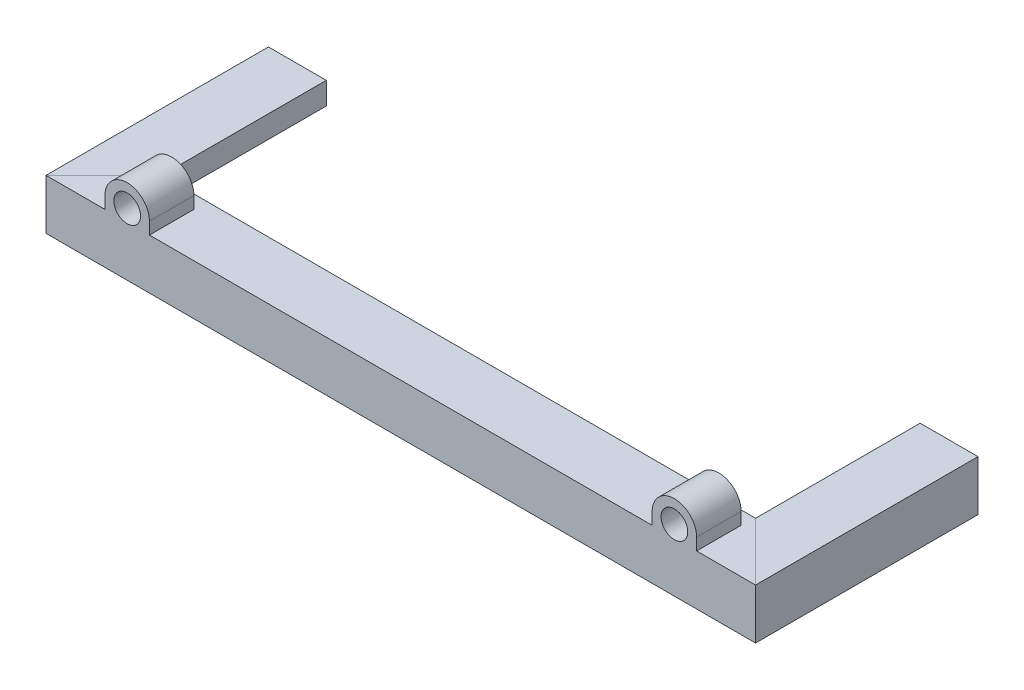
from build123d import *

# Parameters (mm, degrees)
SALIENTE_EXTRUIR1_DEPTH = 10
CROQUIS5_R              = 3
CORTAR_EXTRUIR1_DEPTH   = 169.229753611


with BuildPart() as part:
    # Barrer1: sweep along a path in Croquis3
    with BuildLine(Plane(origin=(0, 0, 0), x_dir=(1, 0, 0), z_dir=(0, 1, 0))) as barrer1_path:
        Line((0, 0), (0, -50))
        Line((0, -50), (159.5, -50))
        Line((159.5, -50), (159.5, 0))
    # Croquis1 → Barrer1 (sweep)
    with BuildSketch(Plane.XY):
        Polygon((0, 0), (0, 11.3), (13, 11.3), (13, 6.3), (5, 6.3), (5, 0), align=None)
    sweep(path=barrer1_path.line, transition=Transition.RIGHT)

    # Croquis4 → Saliente-Extruir1 (add)
    with BuildSketch(Plane.XY.offset(50)):
        with BuildLine():
            Line((13.25, 11.3), (23.25, 11.3))
            Line((23.25, 11.3), (23.25, 14))
            ThreePointArc((23.25, 14), (18.25, 19), (13.25, 14))
            Line((13.25, 14), (13.25, 11.3))
        make_face()
    saliente_extruir1 = extrude(amount=-SALIENTE_EXTRUIR1_DEPTH)

    # Croquis5 → Cortar-Extruir1 (cut, through all)
    with BuildSketch(Plane.XY.offset(50)):
        with Locations((18.25, 14)):
            Circle(CROQUIS5_R)
    cortar_extruir1 = extrude(amount=-CORTAR_EXTRUIR1_DEPTH, mode=Mode.SUBTRACT)

    # Simetría1: Saliente-Extruir1, Cortar-Extruir1 across plane
    add(saliente_extruir1.mirror(Plane(origin=(79.75, 0, 0), x_dir=(0, 0, 1), z_dir=(1, 0, 0))))
    add(cortar_extruir1.mirror(Plane(origin=(79.75, 0, 0), x_dir=(0, 0, 1), z_dir=(1, 0, 0))), mode=Mode.SUBTRACT)


solid = part.part
